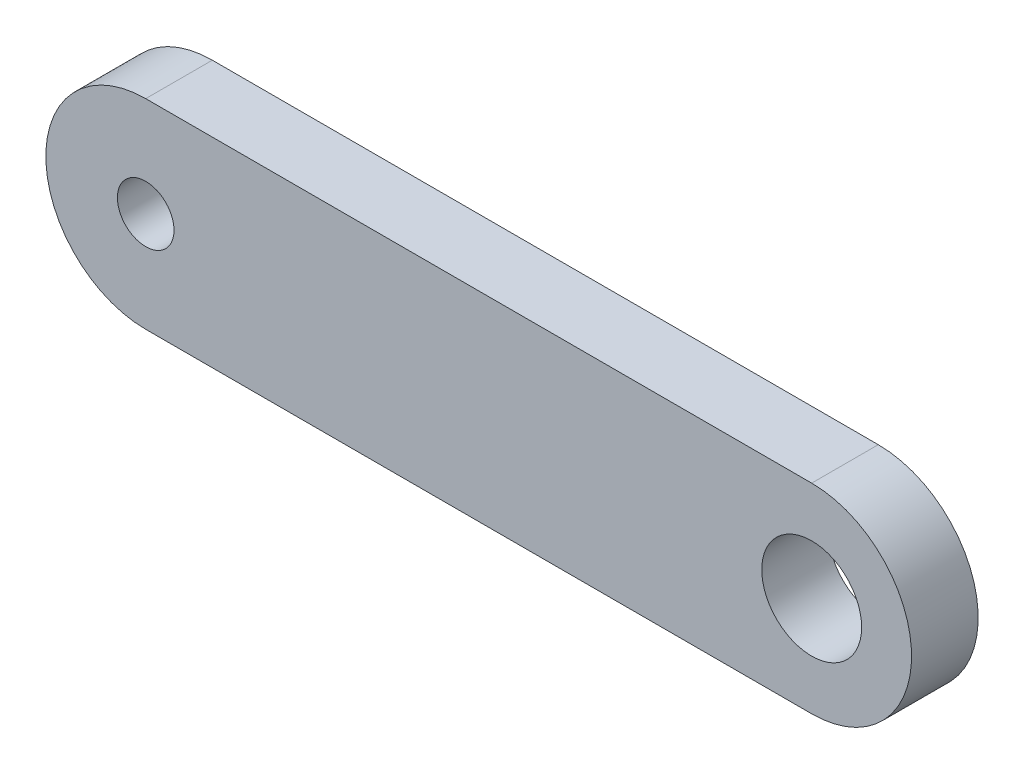
from build123d import *

# Parameters (mm, degrees)
SKETCH_1_R      = 1.5
EXTRUDE_1_DEPTH = 2
SKETCH_4_R      = 1.5
SKETCH_4_R_2    = 0.85
EXTRUDE_6_DEPTH = 2


with BuildPart() as part:
    # 草图1 → 凸台-拉伸1 (new body)
    with BuildSketch(Plane.XY):
        with BuildLine():
            Line((0, 3), (20, 3))
            ThreePointArc((20, 3), (23, 0), (20, -3))
            Line((20, -3), (0, -3))
            ThreePointArc((0, -3), (-3, 0), (0, 3))
        make_face()
        Circle(SKETCH_1_R, mode=Mode.SUBTRACT)
        with Locations((20, 0)):
            Circle(SKETCH_1_R, mode=Mode.SUBTRACT)
    extrude(amount=EXTRUDE_1_DEPTH)

    # 草图4 → 凸台-拉伸6 (add, through all)
    with BuildSketch(Plane(origin=(0, 0, 0), x_dir=(-1, 0, 0), z_dir=(0, 0, -1))):
        Circle(SKETCH_4_R)
        Circle(SKETCH_4_R_2, mode=Mode.SUBTRACT)
    extrude(amount=-EXTRUDE_6_DEPTH)


solid = part.part
